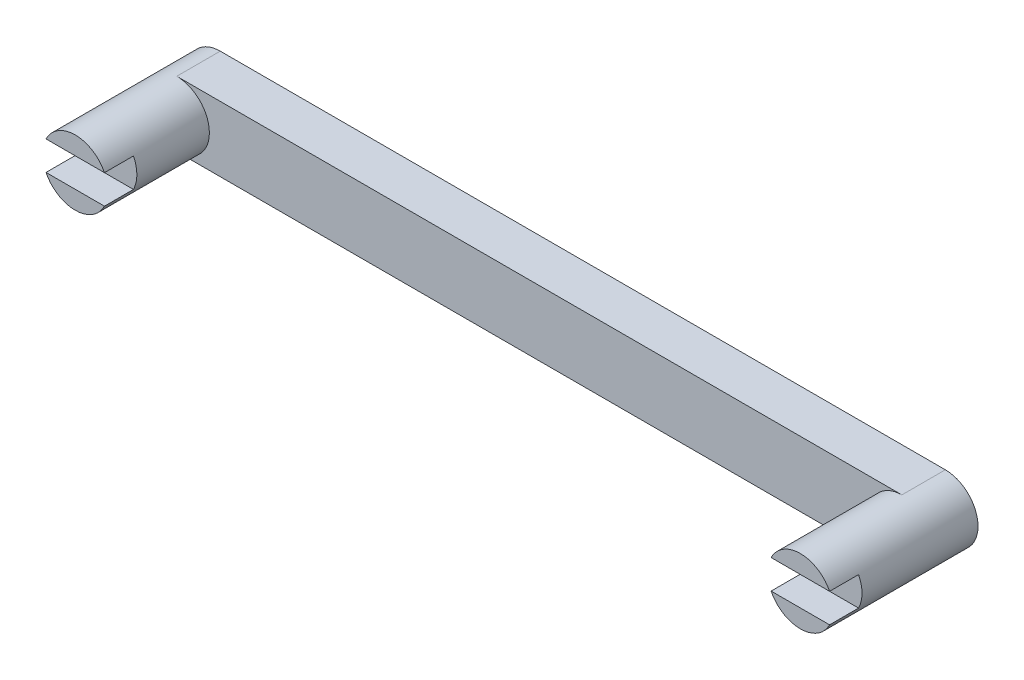
from build123d import *

# Parameters (mm, degrees)
EXTRUDE_1_DEPTH     = 3
SKETCH_1_3_R        = 2.25
EXTRUDE_2_DEPTH     = 10
SKETCH_2_W          = 5
SKETCH_2_H          = 2
CUT_EXTRUDE_1_DEPTH = 2


with BuildPart() as part:
    # 草图1 → 凸台-拉伸1 (new body)
    with BuildSketch(Plane.XY):
        with BuildLine():
            Line((0, -2.25), (50, -2.25))
            ThreePointArc((50, -2.25), (52.25, 0), (50, 2.25))
            Line((50, 2.25), (0, 2.25))
            ThreePointArc((0, 2.25), (-2.25, 0), (0, -2.25))
        make_face()
    extrude(amount=EXTRUDE_1_DEPTH)

    # 草图1<3> → 凸台-拉伸2 (add)
    with BuildSketch(Plane.XY):
        Circle(SKETCH_1_3_R)
        with Locations((50, 0)):
            Circle(SKETCH_1_3_R)
    extrude(amount=EXTRUDE_2_DEPTH)

    # 草图2 → 切除-拉伸1 (cut)
    with BuildSketch(Plane.XY.offset(10)):
        Rectangle(SKETCH_2_W, SKETCH_2_H)
        with Locations((50, 0)):
            Rectangle(SKETCH_2_W, SKETCH_2_H)
    extrude(amount=-CUT_EXTRUDE_1_DEPTH, mode=Mode.SUBTRACT)


solid = part.part
